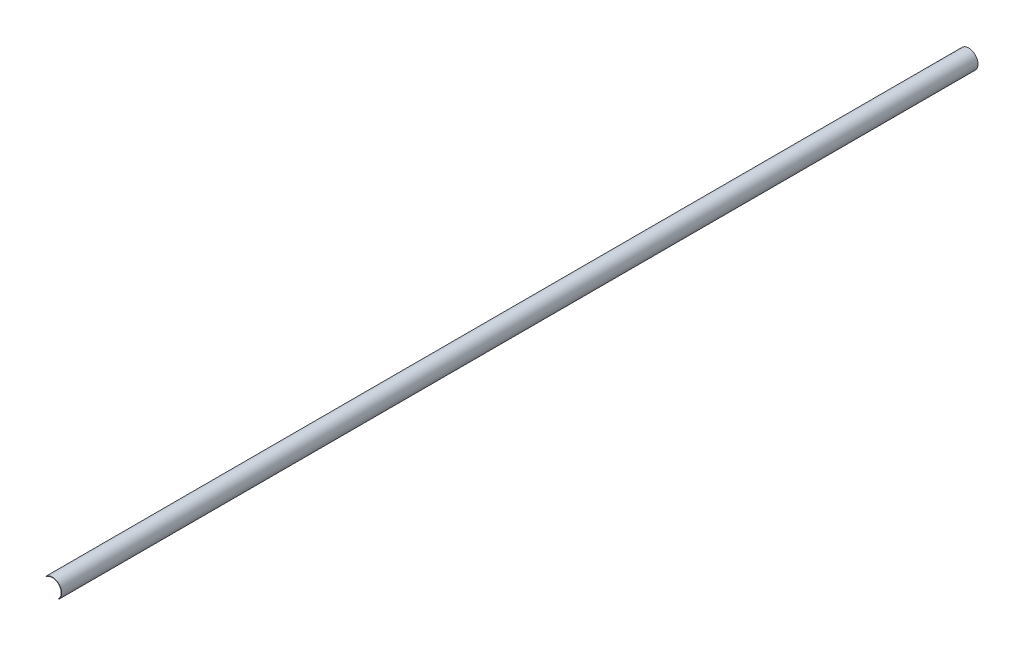
from build123d import *

# Parameters (mm, degrees)
BOSS_EXTRUDE1_DEPTH = 2100


with BuildPart() as part:
    # Sketch1 → Boss-Extrude1 (new body)
    with BuildSketch(Plane.XY):
        with BuildLine():
            Line((14.944638174, -15.317238323), (14.246290596, -14.601479523))
            ThreePointArc((14.246290596, -14.601479523), (14.847887701, 13.989289861), (-13.728027854, 15.089773068))
            Line((-13.728027854, 15.089773068), (-14.400970396, 15.829467826))
            ThreePointArc((-14.400970396, 15.829467826), (15.575725333, 14.675039365), (14.944638174, -15.317238323))
        make_face()
    extrude(amount=BOSS_EXTRUDE1_DEPTH)


solid = part.part
